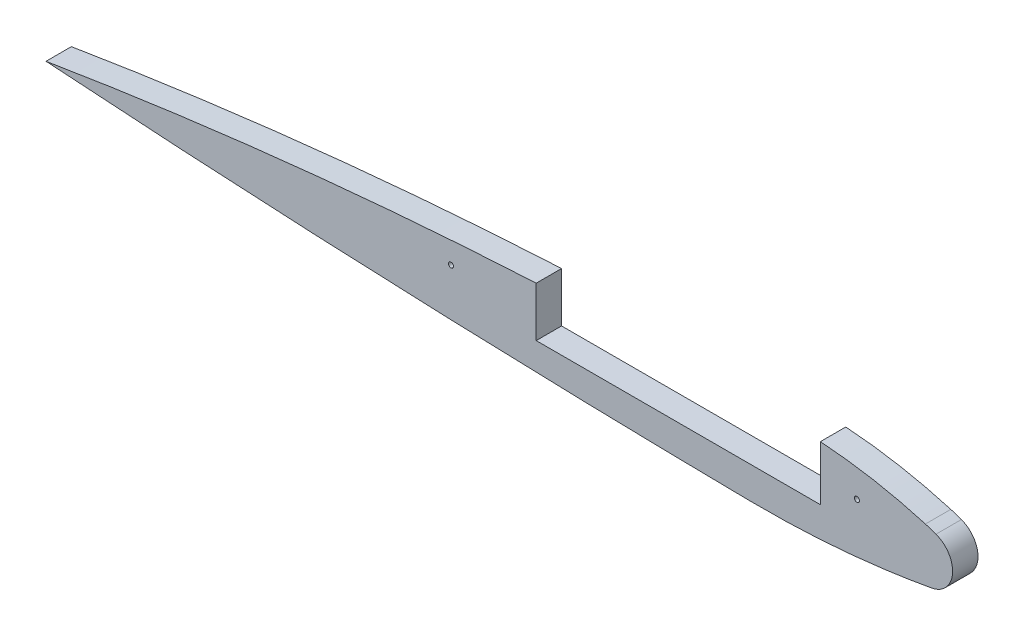
from build123d import *

# Parameters (mm, degrees)
BOSS_EXTRUDE1_DEPTH = 6.35
FILLET1_R           = 6.35
SKETCH2_W           = 71.12
SKETCH2_H           = 11.43
CUT_EXTRUDE1_DEPTH  = 207.956858886
SKETCH3_R           = 0.635
CUT_EXTRUDE2_DEPTH  = 207.956858886
SKETCH6_OUTSIDE_W   = 361.165
SKETCH6_OUTSIDE_H   = 90.651
CUT_EXTRUDE4_DEPTH  = 207.956858886
FILLET3_R           = 6.35
CUT_EXTRUDE5_DEPTH  = 207.31049006


with BuildPart() as part:
    # Sketch1 → Boss-Extrude1 (new body)
    with BuildSketch(Plane.XY):
        with BuildLine():
            add(Edge.make_bspline(
                [(36.979706214, 32.461234237), (-84.593483907, 33.006022806), (-204.294256369, 13.29140622)],
                knots=[1.565963281, 1.565963281, 1.565963281, 1.746596348, 1.746596348, 1.746596348], degree=2, weights=[1, 0.995924234, 1]))
            add(Edge.make_bspline(
                [(-204.294256369, 13.29140622), (-90.184781375, 5.397938815), (24.279187945, 3.948004614)],
                knots=[4.63926443, 4.63926443, 4.63926443, 4.706613661, 4.706613661, 4.706613661], degree=2, weights=[1, 0.999433064, 1]))
            add(Edge.make_bspline(
                [(24.279187945, 3.948004614), (64.56807699, 3.437658533), (103.433890649, 13.29140622)],
                knots=[4.698727851, 4.698727851, 4.698727851, 4.979307673, 4.979307673, 4.979307673], degree=2, weights=[1, 0.9901755, 1]))
            add(Edge.make_bspline(
                [(103.433890649, 13.29140622), (94.233757809, 22.223302177), (81.53716289, 25.9598127)],
                knots=[0.762399197, 0.762399197, 0.762399197, 1.263449558, 1.263449558, 1.263449558], degree=2, weights=[1, 0.968782356, 1]))
            add(Edge.make_bspline(
                [(81.53716289, 25.9598127), (59.792823381, 32.359005074), (36.979706214, 32.461234237)],
                knots=[1.263449558, 1.263449558, 1.263449558, 1.565963281, 1.565963281, 1.565963281], degree=2, weights=[1, 0.988582474, 1]))
        make_face()
    extrude(amount=BOSS_EXTRUDE1_DEPTH)

    # Fillet1
    fillet1_edges = [part.edges().sort_by_distance(p)[0] for p in [
        (103.433890649, 13.29140622, 3.175),
    ]]
    fillet(fillet1_edges, radius=FILLET1_R)

    # Sketch2 → Cut-Extrude1 (cut, through all)
    with BuildSketch(Plane(origin=(0, 0, 0), x_dir=(-1, 0, 0), z_dir=(0, 0, -1))):
        with Locations((46.047690277, 19.812)):
            Rectangle(SKETCH2_W, SKETCH2_H)
    extrude(amount=-CUT_EXTRUDE1_DEPTH, mode=Mode.SUBTRACT)

    # Sketch3 → Cut-Extrude2 (cut, through all)
    with BuildSketch(Plane.XY):
        with Locations((-1.343690277, 19.812)):
            Circle(SKETCH3_R)
        with Locations((-102.943690277, 19.812)):
            Circle(SKETCH3_R)
    extrude(amount=CUT_EXTRUDE2_DEPTH, mode=Mode.SUBTRACT)

    # Sketch6 outside → Cut-Extrude4 (cut, through all)
    with BuildSketch(Plane.XY):
        with Locations((-54.7605, 18.1995)):
            Rectangle(SKETCH6_OUTSIDE_W, SKETCH6_OUTSIDE_H)
        with BuildLine():
            add(Edge.make_bspline(
                [(-18.51330518, 28.052173793), (-112.124661574, 28.471660991), (-204.294256369, 13.29140622)],
                knots=[1.565963281, 1.565963281, 1.565963281, 1.746596348, 1.746596348, 1.746596348], degree=2, weights=[1, 0.995924234, 1]))
            add(Edge.make_bspline(
                [(-204.294256369, 13.29140622), (-116.429960623, 7.213436318), (-28.292704248, 6.096986983)],
                knots=[1.497671776, 1.497671776, 1.497671776, 1.565021007, 1.565021007, 1.565021007], degree=2, weights=[1, 0.999433064, 1]))
            add(Edge.make_bspline(
                [(-28.292704248, 6.096986983), (2.729740317, 5.704020501), (32.656416835, 13.29140622)],
                knots=[4.698727851, 4.698727851, 4.698727851, 4.979307673, 4.979307673, 4.979307673], degree=2, weights=[1, 0.9901755, 1]))
            add(Edge.make_bspline(
                [(32.656416835, 13.29140622), (25.572314548, 20.168966107), (15.79593646, 23.046079209)],
                knots=[0.762399197, 0.762399197, 0.762399197, 1.263449558, 1.263449558, 1.263449558], degree=2, weights=[1, 0.968782356, 1]))
            add(Edge.make_bspline(
                [(15.79593646, 23.046079209), (-0.947204961, 27.973457337), (-18.51330518, 28.052173793)],
                knots=[1.263449558, 1.263449558, 1.263449558, 1.565963281, 1.565963281, 1.565963281], degree=2, weights=[1, 0.988582474, 1]))
        make_face(mode=Mode.SUBTRACT)
    extrude(amount=CUT_EXTRUDE4_DEPTH, mode=Mode.SUBTRACT)

    # Fillet3
    fillet3_edges = [part.edges().sort_by_distance(p)[0] for p in [
        (32.656416835, 13.29140622, 3.175),
    ]]
    fillet(fillet3_edges, radius=FILLET3_R)

    # Sketch8 → Cut-Extrude5 (cut, through all)
    with BuildSketch(Plane.XY):
        with BuildLine():
            Line((-81.607690277, 25.527), (-10.487690277, 25.527))
            Line((-10.487690277, 25.527), (-10.487690277, 27.756704448))
            add(Edge.make_bspline(
                [(-10.487690277, 27.756704448), (-14.494942073, 28.034166876), (-18.51330518, 28.052173793)],
                knots=[1.496256855, 1.496256855, 1.496256855, 1.565963281, 1.565963281, 1.565963281], degree=2, weights=[1, 0.999392688, 1]))
            add(Edge.make_bspline(
                [(-18.51330518, 28.052173793), (-50.08526822, 28.193652721), (-81.607690277, 26.54831499)],
                knots=[1.565963281, 1.565963281, 1.565963281, 1.627031944, 1.627031944, 1.627031944], degree=2, weights=[1, 0.999533864, 1]))
            Line((-81.607690277, 26.54831499), (-81.607690277, 25.527))
        make_face()
    extrude(amount=CUT_EXTRUDE5_DEPTH, mode=Mode.SUBTRACT)


solid = part.part
